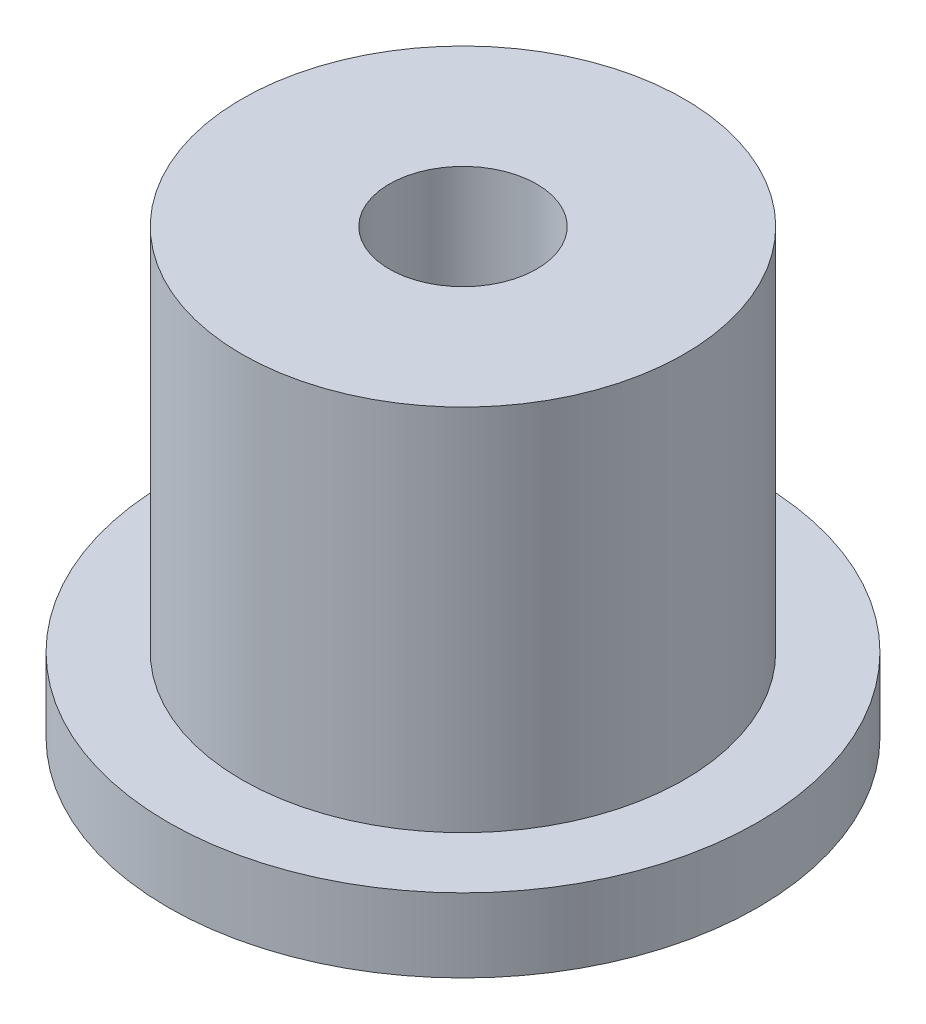
from build123d import *

# Parameters (mm, degrees)
SKETCH1_R           = 25.4
BOSS_EXTRUDE1_DEPTH = 6.35
SKETCH2_R           = 19.05
BOSS_EXTRUDE2_DEPTH = 31.75
SKETCH3_R           = 6.35
CUT_EXTRUDE1_DEPTH  = 38.1


with BuildPart() as part:
    # Sketch1 → Boss-Extrude1 (new body)
    with BuildSketch(Plane(origin=(0, 0, 0), x_dir=(1, 0, 0), z_dir=(0, 1, 0))):
        with Locations(Location((0, 0, 0), (0, 0, 270))):
            Circle(SKETCH1_R)
    extrude(amount=BOSS_EXTRUDE1_DEPTH)

    # Sketch2 → Boss-Extrude2 (add)
    with BuildSketch(Plane(origin=(0, 6.35, 0), x_dir=(1, 0, 0), z_dir=(0, 1, 0))):
        with Locations(Location((0, 0, 0), (0, 0, 270))):
            Circle(SKETCH2_R)
    extrude(amount=BOSS_EXTRUDE2_DEPTH)

    # Sketch3 → Cut-Extrude1 (cut)
    with BuildSketch(Plane.XZ):
        with Locations(Location((0, 0, 0), (0, 0, 270))):
            Circle(SKETCH3_R)
    extrude(amount=-CUT_EXTRUDE1_DEPTH, mode=Mode.SUBTRACT)


solid = part.part
